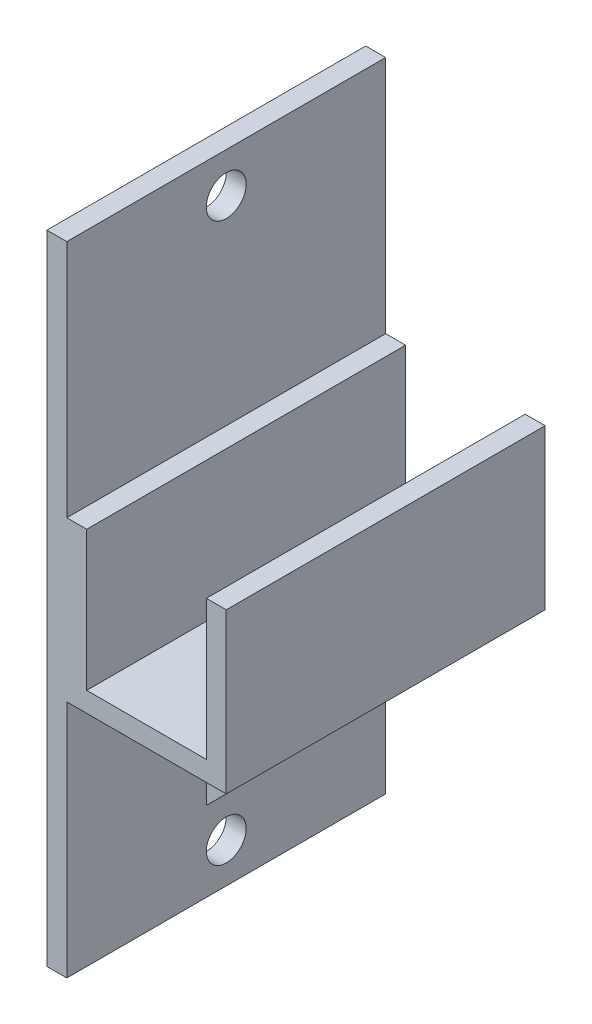
from build123d import *

# Parameters (mm, degrees)
BOSS_EXTRUDE1_DEPTH      = 50.8
SKETCH3_W                = 50.8
SKETCH3_H                = 101.6
SKETCH3_R                = 3.175
BOSS_EXTRUDE2_DEPTH      = 3.175
BOSS_EXTRUDE3_DEPTH      = 3.175
BOSS_EXTRUDE3_DEPTH_BACK = 3.175


with BuildPart() as part:
    # Sketch1 → Boss-Extrude1 (new body)
    with BuildSketch(Plane.XY):
        Polygon((0, 0), (12.7, 0), (12.7, 25.4), (9.525, 25.4), (9.525, 3.175), (0, 3.175), align=None)
    extrude(amount=BOSS_EXTRUDE1_DEPTH)

    # Mirror1: part across plane


with BuildPart() as part_1:
    add(part.part)
    add(part.part.mirror(Plane(origin=(0, 3.175, 50.8), x_dir=(0, 0, 1), z_dir=(1, 0, 0))))

    # Sketch3 → Boss-Extrude2 (add)
    with BuildSketch(Plane.ZY.offset(12.7)):
        with Locations((25.4, 12.7)):
            Rectangle(SKETCH3_W, SKETCH3_H)
        with Locations((25.4, 57.15)):
            Circle(SKETCH3_R, mode=Mode.SUBTRACT)
        with Locations((25.4, -31.75)):
            Circle(SKETCH3_R, mode=Mode.SUBTRACT)
    extrude(amount=BOSS_EXTRUDE2_DEPTH)

    # Sketch4 → Boss-Extrude3 (add, two sides: drawn at the far end of the back side and taken through both)
    with BuildSketch(Plane(origin=(0, 0, 25.4), x_dir=(-1, 0, 0), z_dir=(0, 0, -1)).offset(-BOSS_EXTRUDE3_DEPTH_BACK)):
        Polygon((-12.7, 0), (12.7, -25.4), (12.7, 0), align=None)
    extrude(amount=BOSS_EXTRUDE3_DEPTH + BOSS_EXTRUDE3_DEPTH_BACK)


solid = part_1.part
